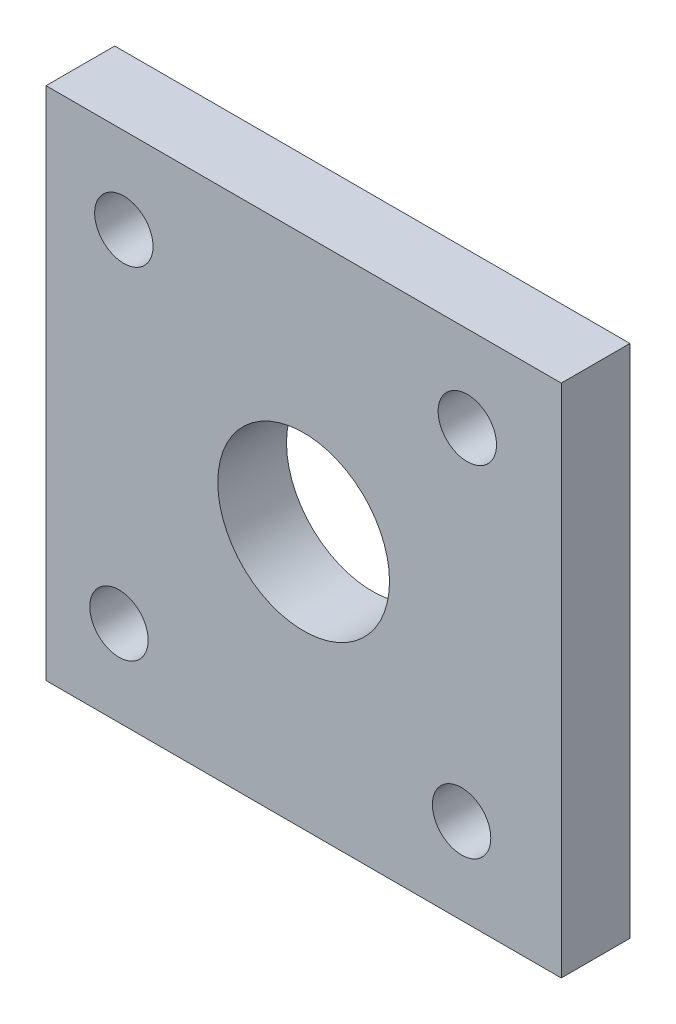
from build123d import *

# Parameters (mm, degrees)
SKETCH1_W           = 30
SKETCH1_H           = 30
BOSS_EXTRUDE1_DEPTH = 4
SKETCH2_R           = 5
CUT_EXTRUDE1_DEPTH  = 23.693121656
SKETCH3_R           = 1.7
CUT_EXTRUDE2_DEPTH  = 23.693121656


with BuildPart() as part:
    # Sketch1 → Boss-Extrude1 (new body)
    with BuildSketch(Plane.XY):
        with Locations((1.122840691, -0.460652591)):
            Rectangle(SKETCH1_W, SKETCH1_H)
    extrude(amount=BOSS_EXTRUDE1_DEPTH)

    # Sketch2 → Cut-Extrude1 (cut, through all)
    with BuildSketch(Plane.XY.offset(4)):
        with Locations((1.122840691, -0.460652591)):
            Circle(SKETCH2_R)
    extrude(amount=-CUT_EXTRUDE1_DEPTH, mode=Mode.SUBTRACT)

    # Sketch3 → Cut-Extrude2 (cut, through all)
    with BuildSketch(Plane.XY.offset(4)):
        with Locations((-9.34798151, 9.539347409)):
            Circle(SKETCH3_R)
        with Locations((10.65201849, 9.539347409)):
            Circle(SKETCH3_R)
        with Locations((-9.630976704, -10.460652591)):
            Circle(SKETCH3_R)
        with Locations((10.320184516, -10.460652591)):
            Circle(SKETCH3_R)
    extrude(amount=-CUT_EXTRUDE2_DEPTH, mode=Mode.SUBTRACT)


solid = part.part
